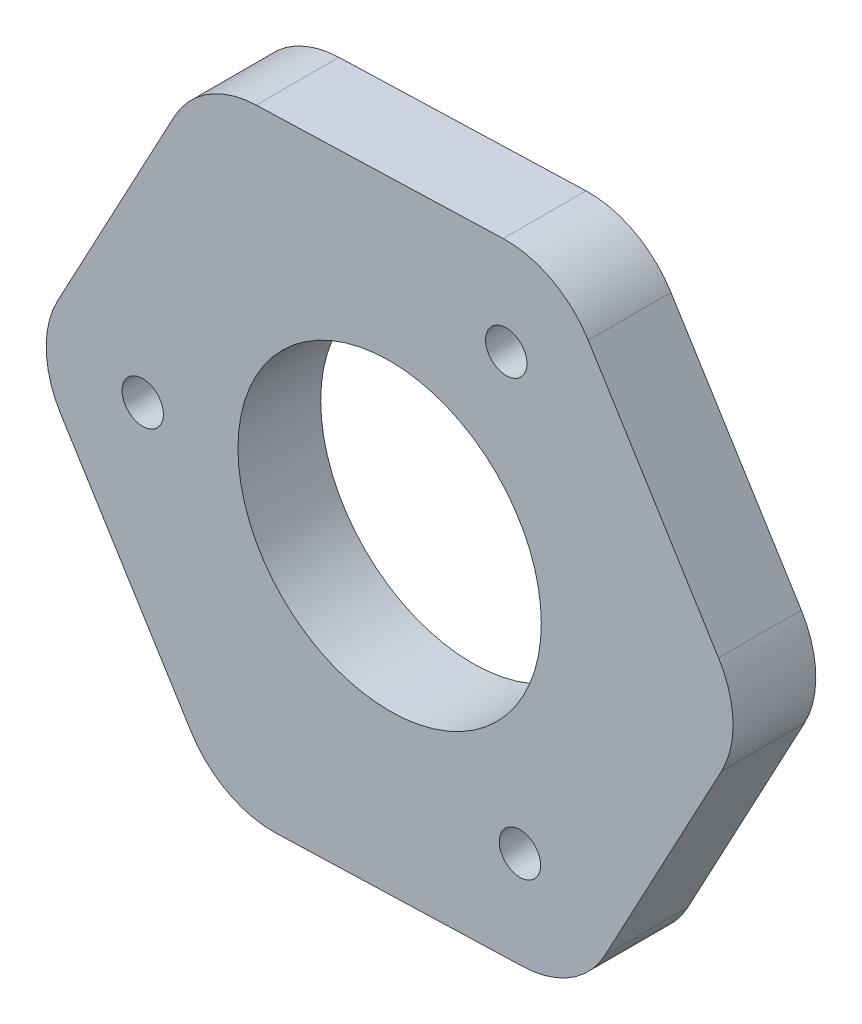
from build123d import *

# Parameters (mm, degrees)
SKETCH1_R           = 1.5
SKETCH1_R_2         = 11
BOSS_EXTRUDE1_DEPTH = 6


with BuildPart() as part:
    # Sketch1 → Boss-Extrude1 (new body)
    with BuildSketch(Plane.XY):
        with BuildLine():
            Line((24.453034096, 353.905456547), (33.903511888, 338.683406525))
            ThreePointArc((33.903511888, 338.683406525), (36.546364709, 336.204527868), (40.074581718, 335.379182388))
            Line((40.074581718, 335.379182388), (57.982502631, 335.952511222))
            ThreePointArc((57.982502631, 335.952511222), (61.450700931, 337.001849574), (63.929579589, 339.644702395))
            Line((63.929579589, 339.644702395), (72.38702271, 355.440081251))
            ThreePointArc((72.38702271, 355.440081251), (73.21236819, 358.968298261), (72.163029838, 362.436496561))
            Line((72.163029838, 362.436496561), (62.712552046, 377.658546583))
            ThreePointArc((62.712552046, 377.658546583), (60.069699226, 380.137425241), (56.541482216, 380.962770721))
            Line((56.541482216, 380.962770721), (38.633561304, 380.389441887))
            ThreePointArc((38.633561304, 380.389441887), (35.165363003, 379.340103535), (32.686484345, 376.697250714))
            Line((32.686484345, 376.697250714), (24.229041225, 360.901871858))
            ThreePointArc((24.229041225, 360.901871858), (23.403695744, 357.373654848), (24.453034096, 353.905456547))
        make_face()
        with Locations((57.758509759, 342.948926532)):
            Circle(SKETCH1_R, mode=Mode.SUBTRACT)
        with Locations((48.308031967, 358.170976554)):
            Circle(SKETCH1_R_2, mode=Mode.SUBTRACT)
        with Locations((56.765475088, 373.966355411)):
            Circle(SKETCH1_R, mode=Mode.SUBTRACT)
        with Locations((30.400111055, 357.59764772)):
            Circle(SKETCH1_R, mode=Mode.SUBTRACT)
    extrude(amount=BOSS_EXTRUDE1_DEPTH)


solid = part.part
